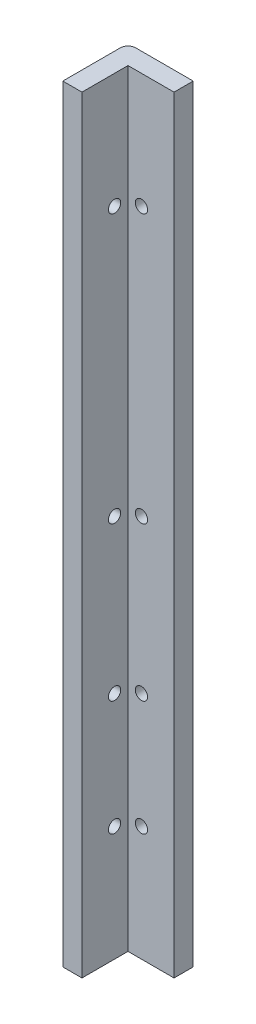
from build123d import *

# Parameters (mm, degrees)
BOSS_EXTRUDE1_DEPTH             = 100
M2X0_4_TAPPED_HOLE2_D           = 1.6
M2X0_4_TAPPED_HOLE2_CSINK_D     = 2.05
M2X0_4_TAPPED_HOLE2_CSINK_ANGLE = 90
LPATTERN1_COUNT                 = 3
LPATTERN1_PITCH                 = 35
M2X0_4_TAPPED_HOLE3_D           = 1.6
M2X0_4_TAPPED_HOLE3_CSINK_D     = 2.05
M2X0_4_TAPPED_HOLE3_CSINK_ANGLE = 90
LPATTERN2_COUNT                 = 3
LPATTERN2_PITCH                 = 35
M2X0_4_TAPPED_HOLE4_D           = 1.6
M2X0_4_TAPPED_HOLE4_CSINK_D     = 2.05
M2X0_4_TAPPED_HOLE4_CSINK_ANGLE = 90
M2X0_4_TAPPED_HOLE5_D           = 1.6
M2X0_4_TAPPED_HOLE5_CSINK_D     = 2.05
M2X0_4_TAPPED_HOLE5_CSINK_ANGLE = 90


with BuildPart() as part:
    # Sketch2 → Boss-Extrude1 (new body)
    with BuildSketch(Plane(origin=(0, 0, 0), x_dir=(1, 0, 0), z_dir=(0, 1, 0))):
        with BuildLine():
            Line((0, 0), (0, 7.5))
            ThreePointArc((0, 7.5), (0.292893219, 8.207106781), (1, 8.5))
            Line((1, 8.5), (8.5, 8.5))
            Line((8.5, 8.5), (8.5, 6))
            Line((8.5, 6), (2.5, 6))
            Line((2.5, 6), (2.5, 0))
            Line((2.5, 0), (0, 0))
        make_face()
    extrude(amount=BOSS_EXTRUDE1_DEPTH)

    # M2x0.4 Tapped Hole2 (through all)
    with Locations(Plane(origin=(0, 0, -8.5), x_dir=(-1, 0, 0), z_dir=(0, 0, -1))):
        with Locations((-4.25, 15)):
            m2x0_4_tapped_hole2 = CounterSinkHole(M2X0_4_TAPPED_HOLE2_D / 2, M2X0_4_TAPPED_HOLE2_CSINK_D / 2, counter_sink_angle=M2X0_4_TAPPED_HOLE2_CSINK_ANGLE)

    # LPattern1: M2x0.4 Tapped Hole2 ×3
    with Locations(*[(0, i * LPATTERN1_PITCH, 0) for i in range(1, LPATTERN1_COUNT)]):
        add(m2x0_4_tapped_hole2, mode=Mode.SUBTRACT)

    # M2x0.4 Tapped Hole3 (through all)
    with Locations(Plane.ZY):
        with Locations((-4.25, 15)):
            m2x0_4_tapped_hole3 = CounterSinkHole(M2X0_4_TAPPED_HOLE3_D / 2, M2X0_4_TAPPED_HOLE3_CSINK_D / 2, counter_sink_angle=M2X0_4_TAPPED_HOLE3_CSINK_ANGLE)

    # LPattern2: M2x0.4 Tapped Hole3 ×3
    with Locations(*[(0, i * LPATTERN2_PITCH, 0) for i in range(1, LPATTERN2_COUNT)]):
        add(m2x0_4_tapped_hole3, mode=Mode.SUBTRACT)

    # M2x0.4 Tapped Hole4 (through all)
    with Locations(Plane(origin=(0, 0, -8.5), x_dir=(-1, 0, 0), z_dir=(0, 0, -1))):
        with Locations((-4.25, 30)):
            CounterSinkHole(M2X0_4_TAPPED_HOLE4_D / 2, M2X0_4_TAPPED_HOLE4_CSINK_D / 2, counter_sink_angle=M2X0_4_TAPPED_HOLE4_CSINK_ANGLE)

    # M2x0.4 Tapped Hole5 (through all)
    with Locations(Plane.ZY):
        with Locations((-4.25, 30)):
            CounterSinkHole(M2X0_4_TAPPED_HOLE5_D / 2, M2X0_4_TAPPED_HOLE5_CSINK_D / 2, counter_sink_angle=M2X0_4_TAPPED_HOLE5_CSINK_ANGLE)


solid = part.part
